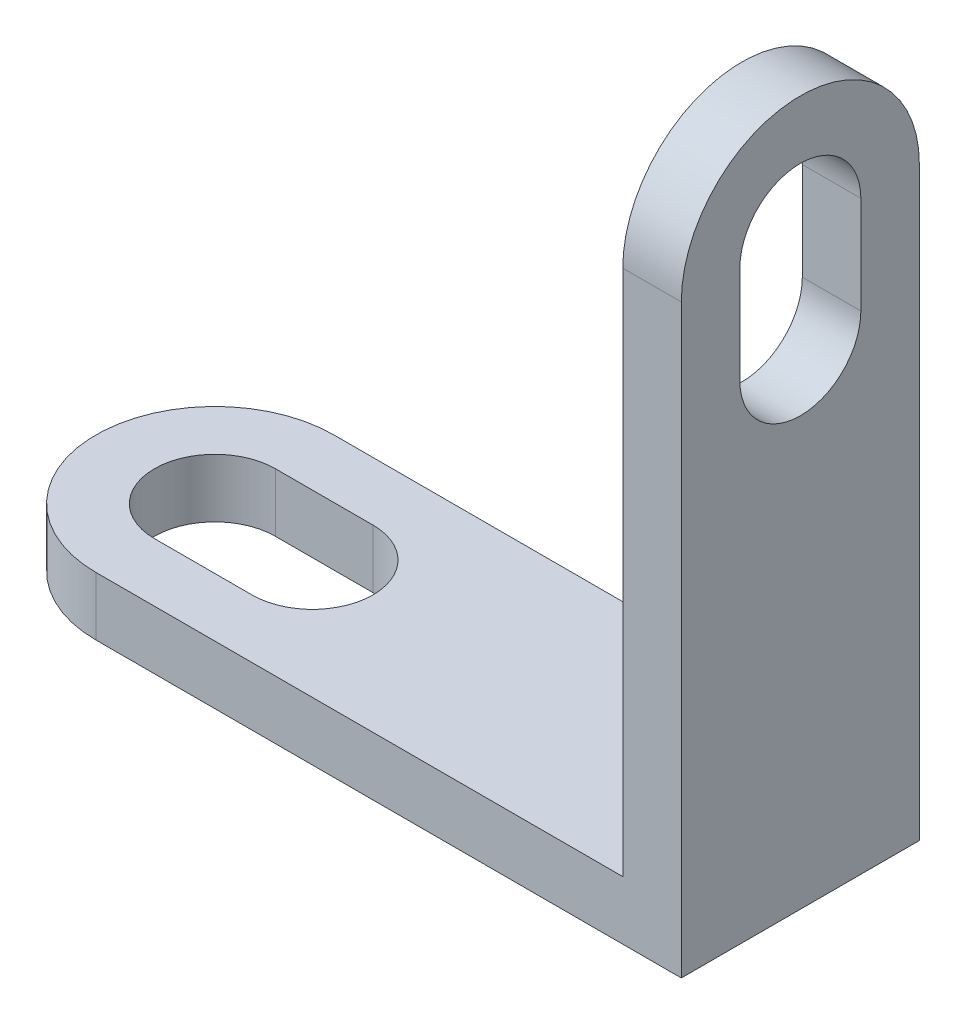
from build123d import *

# Parameters (mm, degrees)
BOSS_EXTRUDE1_DEPTH = 3
BOSS_EXTRUDE3_DEPTH = 3


with BuildPart() as part:
    # Sketch1 → Boss-Extrude1 (new body)
    with BuildSketch(Plane(origin=(0, 0, 0), x_dir=(1, 0, 0), z_dir=(0, 1, 0))):
        with BuildLine():
            Line((0, -6.1), (-30, -6.1))
            ThreePointArc((-30, -6.1), (-36.1, 0), (-30, 6.1))
            Line((-30, 6.1), (0, 6.1))
            Line((0, 6.1), (0, -6.1))
        make_face()
        with BuildLine():
            Line((-30, 3.1), (-25, 3.1))
            ThreePointArc((-25, 3.1), (-21.9, 0), (-25, -3.1))
            Line((-25, -3.1), (-30, -3.1))
            ThreePointArc((-30, -3.1), (-33.1, 0), (-30, 3.1))
        make_face(mode=Mode.SUBTRACT)
    extrude(amount=BOSS_EXTRUDE1_DEPTH)

    # Sketch4 → Boss-Extrude3 (add)
    with BuildSketch(Plane(origin=(0, 0, 0), x_dir=(0, 0, -1), z_dir=(1, 0, 0))):
        with BuildLine():
            Line((-6.1, 0), (-6.1, 30))
            ThreePointArc((-6.1, 30), (0, 36.1), (6.1, 30))
            Line((6.1, 30), (6.1, 0))
            Line((6.1, 0), (-6.1, 0))
        make_face()
        with BuildLine():
            Line((3.1, 30), (3.1, 25))
            ThreePointArc((3.1, 25), (0, 21.9), (-3.1, 25))
            Line((-3.1, 25), (-3.1, 30))
            ThreePointArc((-3.1, 30), (0, 33.1), (3.1, 30))
        make_face(mode=Mode.SUBTRACT)
    extrude(amount=-BOSS_EXTRUDE3_DEPTH)


solid = part.part
